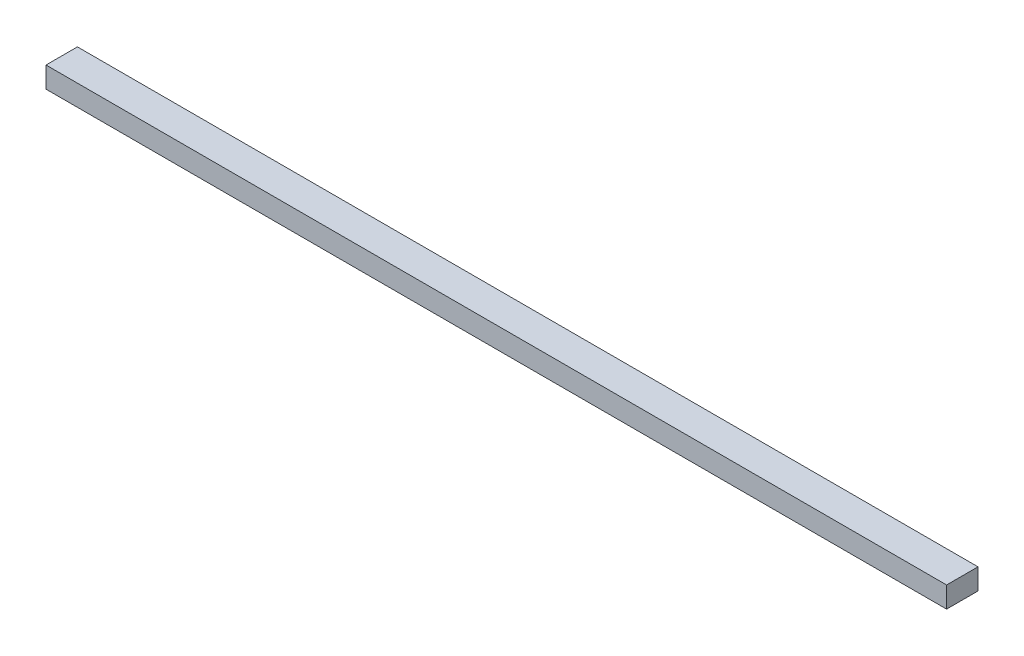
from build123d import *

# Parameters (mm, degrees)
SKETCH2_W           = 86
SKETCH2_H           = 2
BOSS_EXTRUDE1_DEPTH = 3


with BuildPart() as part:
    # Sketch2 → Boss-Extrude1 (new body)
    with BuildSketch(Plane.XY):
        Rectangle(SKETCH2_W, SKETCH2_H)
    extrude(amount=BOSS_EXTRUDE1_DEPTH)


solid = part.part
